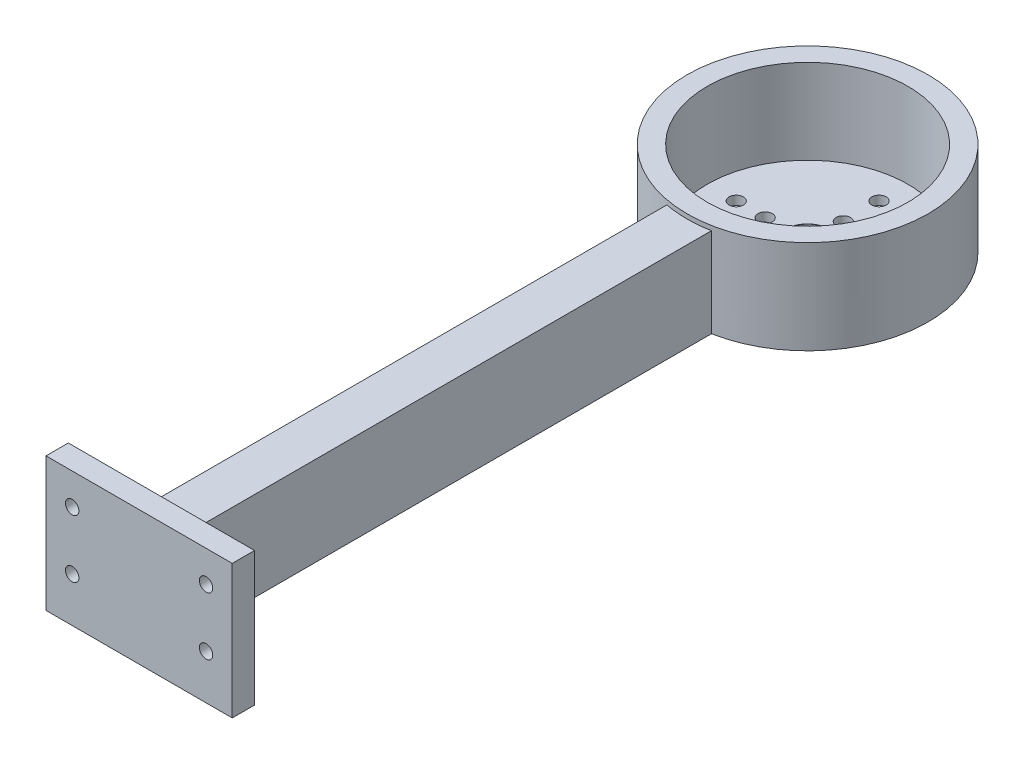
from build123d import *

# Parameters (mm, degrees)
SKETCH1_W                        = 41.73
SKETCH1_H                        = 30
BOSS_EXTRUDE1_DEPTH              = 5
SKETCH2_W                        = 10
SKETCH2_H                        = 20
BOSS_EXTRUDE3_DEPTH              = 144.78
BOSS_EXTRUDE5_DEPTH              = 1
BOSS_EXTRUDE5_DEPTH_BACK         = 8
SKETCH3_R                        = 27
SKETCH3_R_2                      = 22.5
SKETCH4_R                        = 22.5
CUT_EXTRUDE3_DEPTH               = 176.676886357
SKETCH7_R                        = 27
BOSS_EXTRUDE6_DEPTH              = 20
CUT_EXTRUDE5_START               = -18
SKETCH4_2_R                      = 22.5
CUT_EXTRUDE5_DEPTH               = 18
F_3_0MM_DOWEL_HOLE3_D            = 3
F_3_0MM_DOWEL_HOLE3_DEPTH        = 5
F_3_0MM_DOWEL_HOLE3_CSINK_D      = 3.05
F_3_0MM_DOWEL_HOLE3_CSINK_ANGLE  = 90
F_10_0MM_DOWEL_HOLE1_D           = 10
F_10_0MM_DOWEL_HOLE1_CSINK_D     = 10.05
F_10_0MM_DOWEL_HOLE1_CSINK_ANGLE = 90
F_3_0MM_DOWEL_HOLE4_D            = 3.2


with BuildPart() as part:
    # Sketch1 → Boss-Extrude1 (new body)
    with BuildSketch(Plane.XY):
        Rectangle(SKETCH1_W, SKETCH1_H)
    extrude(amount=BOSS_EXTRUDE1_DEPTH)

    # Sketch2 → Boss-Extrude3 (add)
    with BuildSketch(Plane(origin=(0, 0, 0), x_dir=(-1, 0, 0), z_dir=(0, 0, -1))):
        Rectangle(SKETCH2_W, SKETCH2_H)
    extrude(amount=BOSS_EXTRUDE3_DEPTH)

    # Sketch3 → Boss-Extrude5 (add, two sides: drawn at the far end of the back side and taken through both)
    with BuildSketch(Plane(origin=(0, 10, 0), x_dir=(1, 0, 0), z_dir=(0, 1, 0)).offset(-BOSS_EXTRUDE5_DEPTH_BACK)):
        with Locations(Location((0, 144.78, 0), (0, 0, 270))):
            Circle(SKETCH3_R)
        with Locations(Location((0, 144.78, 0), (0, 0, 270))):
            Circle(SKETCH3_R_2, mode=Mode.SUBTRACT)
    extrude(amount=BOSS_EXTRUDE5_DEPTH + BOSS_EXTRUDE5_DEPTH_BACK)

    # Sketch4 → Cut-Extrude3 (cut, through all)
    with BuildSketch(Plane(origin=(0, 10, 0), x_dir=(1, 0, 0), z_dir=(0, 1, 0))):
        with Locations(Location((0, 144.78, 0), (0, 0, 270))):
            Circle(SKETCH4_R)
    extrude(amount=-CUT_EXTRUDE3_DEPTH, mode=Mode.SUBTRACT)

    # Sketch7 → Boss-Extrude6 (add)
    with BuildSketch(Plane(origin=(0, 10, 0), x_dir=(1, 0, 0), z_dir=(0, 1, 0))):
        with Locations(Location((0, 144.78, 0), (0, 0, 270))):
            Circle(SKETCH7_R)
    extrude(amount=-BOSS_EXTRUDE6_DEPTH)

    # Sketch4<2> → Cut-Extrude5 (cut)
    with BuildSketch(Plane(origin=(0, 10, 0), x_dir=(1, 0, 0), z_dir=(0, 1, 0)).offset(CUT_EXTRUDE5_START)):
        with Locations(Location((0, 144.78, 0), (0, 0, 270))):
            Circle(SKETCH4_2_R)
    extrude(amount=CUT_EXTRUDE5_DEPTH, mode=Mode.SUBTRACT)

    # Ø3.0mm Dowel Hole3
    with Locations(Plane(origin=(0, 0, 0), x_dir=(-1, 0, 0), z_dir=(0, 0, -1))):
        with Locations((15, 8), (-15, 8), (15, -5), (-15, -5)):
            CounterSinkHole(F_3_0MM_DOWEL_HOLE3_D / 2, F_3_0MM_DOWEL_HOLE3_CSINK_D / 2, depth=F_3_0MM_DOWEL_HOLE3_DEPTH, counter_sink_angle=F_3_0MM_DOWEL_HOLE3_CSINK_ANGLE)

    # Ø10.0mm Dowel Hole1 (through all)
    with Locations(Plane(origin=(0, -8, 0), x_dir=(1, 0, 0), z_dir=(0, 1, 0))):
        with Locations((0, 144.78)):
            CounterSinkHole(F_10_0MM_DOWEL_HOLE1_D / 2, F_10_0MM_DOWEL_HOLE1_CSINK_D / 2, counter_sink_angle=F_10_0MM_DOWEL_HOLE1_CSINK_ANGLE)

    # Ø3.0mm Dowel Hole4 (through all)
    with Locations(Plane(origin=(0, -8, 0), x_dir=(1, 0, 0), z_dir=(0, 1, 0))):
        with Locations((0, 128.78), (0, 136.78), (16, 144.78), (9.5, 144.78), (0, 160.78), (0, 152.78), (-16, 144.78), (-9.5, 144.78)):
            Hole(F_3_0MM_DOWEL_HOLE4_D / 2)


solid = part.part
